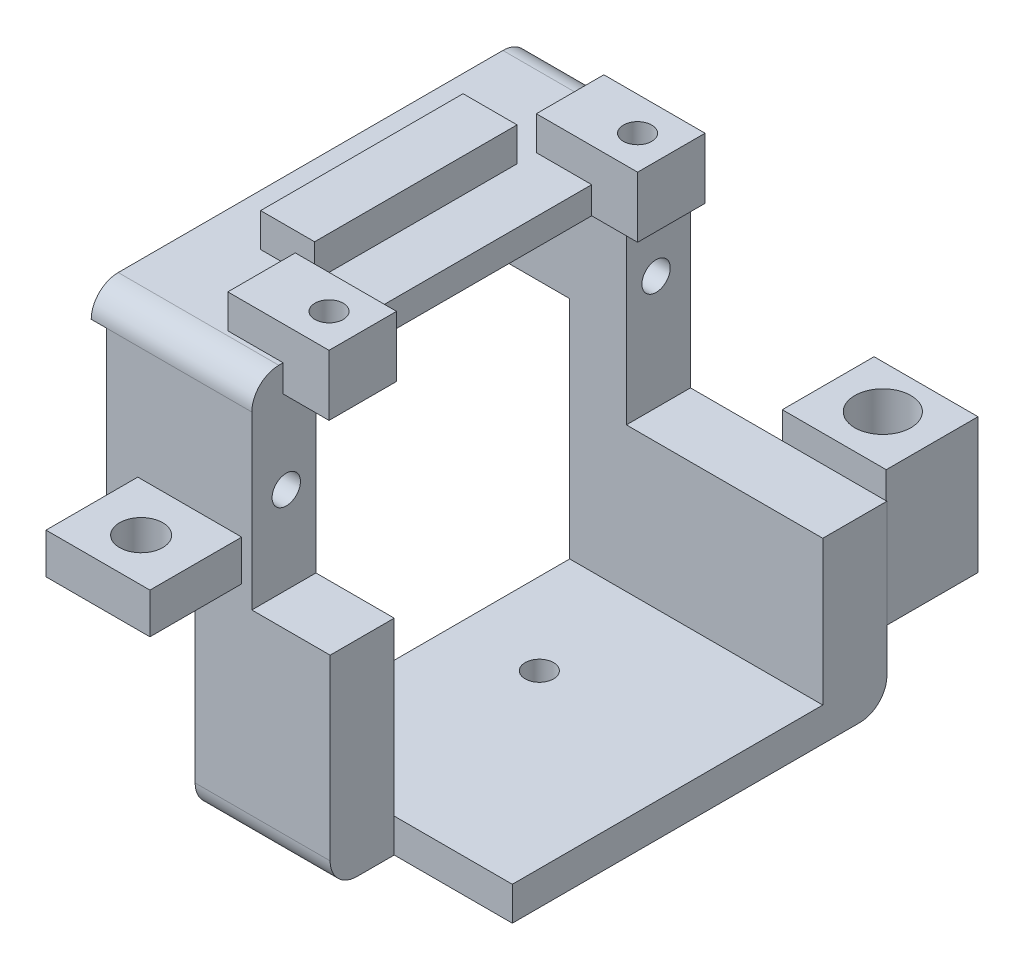
from build123d import *

# Parameters (mm, degrees)
BOSS_EXTRUDE1_DEPTH      = 2.5
BOSS_EXTRUDE2_DEPTH      = 12.7
BOSS_EXTRUDE3_START      = 12.7
SKETCH3_W                = 11.9
SKETCH3_H                = 4.75
SKETCH3_W_2              = 10.75
BOSS_EXTRUDE3_DEPTH      = 12.7
BOSS_EXTRUDE4_START      = 25.4
SKETCH3_3_W              = 11.9
SKETCH3_3_H              = 4.75
SKETCH3_3_W_2            = 10.75
SKETCH3_3_W_3            = 1.15
BOSS_EXTRUDE4_DEPTH      = 2
CUT_EXTRUDE1_START       = -1.1
SKETCH2_R                = 1.05
CUT_EXTRUDE1_DEPTH       = 8
CUT_EXTRUDE2_START       = 3.1
SKETCH2_3_R              = 1.05
CUT_EXTRUDE2_DEPTH       = 8
BOSS_EXTRUDE5_START      = 17
SKETCH1_4_R              = 1.6
BOSS_EXTRUDE5_DEPTH      = 3
BOSS_EXTRUDE6_START      = 12.7
SKETCH1_7_W              = 7.7
SKETCH1_7_H              = 6.8
SKETCH1_7_R              = 2.075
BOSS_EXTRUDE6_DEPTH      = 10
FILLET1_R                = 2
CUT_EXTRUDE3_START       = 12.7
SKETCH5_W                = 14.55
SKETCH5_H                = 4.75
CUT_EXTRUDE3_DEPTH       = 2
CUT_EXTRUDE4_START       = 12.7
SKETCH6_W                = 7.7
SKETCH6_H                = 4.75
CUT_EXTRUDE4_DEPTH       = 4
BOSS_EXTRUDE7_DEPTH      = 2.5
BOSS_EXTRUDE7_DEPTH_BACK = 2
BOSS_EXTRUDE7_START      = 27.4
SKETCH7_W                = 4
SKETCH7_H                = 15
SKETCH7_W_2              = 5
SKETCH7_H_2              = 5
SKETCH7_R                = 1.05
SKETCH7_W_3              = 2.5
BOSS_EXTRUDE8_START      = -2.5
SKETCH8_W                = 5
SKETCH8_H                = 5
SKETCH8_R                = 1.05
BOSS_EXTRUDE8_DEPTH      = 4.1
CUT_EXTRUDE5_DEPTH       = 42.675352428
CUT_EXTRUDE5_DEPTH_BACK  = 42.675352428
SKETCH8_2_R              = 1.05
CUT_EXTRUDE6_START       = 25.4
SKETCH7_4_R              = 1.05
CUT_EXTRUDE6_DEPTH       = 4.5


with BuildPart() as part:
    # Sketch1 → Boss-Extrude1 (new body)
    with BuildSketch(Plane(origin=(0, 0, 0), x_dir=(1, 0, 0), z_dir=(0, 1, 0))):
        Polygon((-1.1, 16.25), (-1.1, -16.25), (8.9, -16.25), (8.9, -11.5), (17.65, -11.5), (17.65, 16.25), align=None)
    extrude(amount=-BOSS_EXTRUDE1_DEPTH)

    # Sketch1<3> → Boss-Extrude2 (add)
    with BuildSketch(Plane(origin=(0, 0, 0), x_dir=(1, 0, 0), z_dir=(0, 1, 0))):
        Polygon((9.9, 16.25), (-1.1, 16.25), (-1.1, 11.5), (17.65, 11.5), (17.65, 16.25), (17.6, 16.25), align=None)
        Polygon((8.9, -11.5), (-1.1, -11.5), (-1.1, -16.25), (2.35, -16.25), (8.9, -16.25), align=None)
    extrude(amount=BOSS_EXTRUDE2_DEPTH)

    # Sketch3 → Boss-Extrude3 (add)
    with BuildSketch(Plane(origin=(0, 0, 0), x_dir=(1, 0, 0), z_dir=(0, 1, 0)).offset(BOSS_EXTRUDE3_START)):
        with Locations((-2.85, 13.875)):
            Rectangle(SKETCH3_W, SKETCH3_H)
        with Locations((-2.275, -13.875)):
            Rectangle(SKETCH3_W_2, SKETCH3_H)
    extrude(amount=BOSS_EXTRUDE3_DEPTH)

    # Sketch3<3> → Boss-Extrude4 (add)
    with BuildSketch(Plane(origin=(0, 0, 0), x_dir=(1, 0, 0), z_dir=(0, 1, 0)).offset(BOSS_EXTRUDE4_START)):
        with Locations((-2.85, 13.875)):
            Rectangle(SKETCH3_3_W, SKETCH3_3_H)
        Polygon((3.1, -11.5), (3.1, 11.5), (-8.8, 11.5), (-8.8, -11.5), (-7.65, -11.5), align=None)
        with Locations((-2.275, -13.875)):
            Rectangle(SKETCH3_3_W_2, SKETCH3_3_H)
        with Locations((-8.225, -13.875)):
            Rectangle(SKETCH3_3_W_3, SKETCH3_3_H)
    extrude(amount=BOSS_EXTRUDE4_DEPTH)

    # Sketch2 → Cut-Extrude1 (cut)
    with BuildSketch(Plane(origin=(0, 0, 0), x_dir=(0, 0, -1), z_dir=(1, 0, 0)).offset(CUT_EXTRUDE1_START)):
        with Locations(Location((-13.7, 6.45, 0), (0, 0, 180))):
            Circle(SKETCH2_R)
        with Locations(Location((13.7, 6.45, 0), (0, 0, 180))):
            Circle(SKETCH2_R)
    extrude(amount=CUT_EXTRUDE1_DEPTH, mode=Mode.SUBTRACT)

    # Sketch2<3> → Cut-Extrude2 (cut)
    with BuildSketch(Plane(origin=(0, 0, 0), x_dir=(0, 0, -1), z_dir=(1, 0, 0)).offset(CUT_EXTRUDE2_START)):
        with Locations(Location((13.7, 19.15, 0), (0, 0, 180))):
            Circle(SKETCH2_3_R)
        with Locations(Location((-13.7, 19.15, 0), (0, 0, 180))):
            Circle(SKETCH2_3_R)
    extrude(amount=-CUT_EXTRUDE2_DEPTH, mode=Mode.SUBTRACT)

    # Sketch1<4> → Boss-Extrude5 (add)
    with BuildSketch(Plane(origin=(0, 0, 0), x_dir=(1, 0, 0), z_dir=(0, 1, 0)).offset(BOSS_EXTRUDE5_START)):
        Polygon((2.35, -16.25), (-1.1, -16.25), (-3.8, -16.25), (-5.35, -16.25), (-5.35, -23.05), (2.35, -23.05), align=None)
        with Locations(Location((-1.5, -19.85, 0), (0, 0, 270))):
            Circle(SKETCH1_4_R, mode=Mode.SUBTRACT)
    extrude(amount=-BOSS_EXTRUDE5_DEPTH)

    # Sketch1<7> → Boss-Extrude6 (add)
    with BuildSketch(Plane(origin=(0, 0, 0), x_dir=(1, 0, 0), z_dir=(0, 1, 0)).offset(BOSS_EXTRUDE6_START)):
        with Locations((13.75, 19.65)):
            Rectangle(SKETCH1_7_W, SKETCH1_7_H)
        with Locations(Location((13.75, 19.85, 0), (0, 0, 270))):
            Circle(SKETCH1_7_R, mode=Mode.SUBTRACT)
    extrude(amount=-BOSS_EXTRUDE6_DEPTH)

    # Fillet1
    fillet1_edges = [part.edges().sort_by_distance(p)[0] for p in [
        (3.9, -2.5, 16.25),
        (-2.85, 27.4, 16.25),
        (8.275, -2.5, -16.25),
        (-2.85, 27.4, -16.25),
    ]]
    fillet(fillet1_edges, radius=FILLET1_R)

    # Sketch5 → Cut-Extrude3 (cut)
    with BuildSketch(Plane(origin=(0, 0, 0), x_dir=(1, 0, 0), z_dir=(0, 1, 0)).offset(CUT_EXTRUDE3_START)):
        with Locations((10.375, 13.875)):
            Rectangle(SKETCH5_W, SKETCH5_H)
    extrude(amount=-CUT_EXTRUDE3_DEPTH, mode=Mode.SUBTRACT)

    # Sketch6 → Cut-Extrude4 (cut)
    with BuildSketch(Plane(origin=(0, 0, 0), x_dir=(1, 0, 0), z_dir=(0, 1, 0)).offset(CUT_EXTRUDE4_START)):
        with Locations((-4.95, 13.875)):
            Rectangle(SKETCH6_W, SKETCH6_H)
    extrude(amount=CUT_EXTRUDE4_DEPTH, mode=Mode.SUBTRACT)

    # Sketch7 → Boss-Extrude7 (add, two sides: drawn at the far end of the back side and taken through both)
    # profile 1 of 5: a face of its own
    with BuildSketch(Plane(origin=(0, 0, 0), x_dir=(1, 0, 0), z_dir=(0, 1, 0)).offset(BOSS_EXTRUDE7_START - BOSS_EXTRUDE7_DEPTH_BACK)):
        with Locations((-3, 0)):
            Rectangle(SKETCH7_W, SKETCH7_H)
    # profile 2 of 5: a face of its own
    with BuildSketch(Plane(origin=(0, 0, 0), x_dir=(1, 0, 0), z_dir=(0, 1, 0)).offset(BOSS_EXTRUDE7_START - BOSS_EXTRUDE7_DEPTH_BACK)):
        with Locations((4, -11.43)):
            Rectangle(SKETCH7_W_2, SKETCH7_H_2)
        with Locations(Location((4, -11.43, 0), (0, 0, 211.002719134))):
            Circle(SKETCH7_R, mode=Mode.SUBTRACT)
    # profile 3 of 5: a face of its own
    with BuildSketch(Plane(origin=(0, 0, 0), x_dir=(1, 0, 0), z_dir=(0, 1, 0)).offset(BOSS_EXTRUDE7_START - BOSS_EXTRUDE7_DEPTH_BACK)):
        with Locations((0.25, -11.43)):
            Rectangle(SKETCH7_W_3, SKETCH7_H_2)
    # profile 4 of 5: a face of its own
    with BuildSketch(Plane(origin=(0, 0, 0), x_dir=(1, 0, 0), z_dir=(0, 1, 0)).offset(BOSS_EXTRUDE7_START - BOSS_EXTRUDE7_DEPTH_BACK)):
        with Locations((0.25, 11.43)):
            Rectangle(SKETCH7_W_3, SKETCH7_H_2)
    # profile 5 of 5: a face of its own
    with BuildSketch(Plane(origin=(0, 0, 0), x_dir=(1, 0, 0), z_dir=(0, 1, 0)).offset(BOSS_EXTRUDE7_START - BOSS_EXTRUDE7_DEPTH_BACK)):
        with Locations((4, 11.43)):
            Rectangle(SKETCH7_W_2, SKETCH7_H_2)
        with Locations(Location((4, 11.43, 0), (0, 0, 211.002719134))):
            Circle(SKETCH7_R, mode=Mode.SUBTRACT)
    extrude(amount=BOSS_EXTRUDE7_DEPTH + BOSS_EXTRUDE7_DEPTH_BACK)

    # Sketch8 → Boss-Extrude8 (add)
    with BuildSketch(Plane(origin=(0, 0, 0), x_dir=(1, 0, 0), z_dir=(0, 1, 0)).offset(BOSS_EXTRUDE8_START)):
        with Locations((4.95, 3.2)):
            Rectangle(SKETCH8_W, SKETCH8_H)
        with Locations(Location((4.95, 3.2, 0), (0, 0, 270))):
            Circle(SKETCH8_R, mode=Mode.SUBTRACT)
    extrude(amount=-BOSS_EXTRUDE8_DEPTH)

    # Sketch8<2> → Cut-Extrude5 (cut, two sides: drawn at the far end of the back side and taken through both)
    with BuildSketch(Plane(origin=(0, 0, 0), x_dir=(1, 0, 0), z_dir=(0, 1, 0)).offset(-CUT_EXTRUDE5_DEPTH_BACK)):
        with Locations(Location((4.95, 3.2, 0), (0, 0, 270))):
            Circle(SKETCH8_2_R)
    extrude(amount=CUT_EXTRUDE5_DEPTH + CUT_EXTRUDE5_DEPTH_BACK, mode=Mode.SUBTRACT)

    # Sketch7<4> → Cut-Extrude6 (cut)
    with BuildSketch(Plane(origin=(0, 0, 0), x_dir=(1, 0, 0), z_dir=(0, 1, 0)).offset(CUT_EXTRUDE6_START)):
        with Locations(Location((4, 11.43, 0), (0, 0, 176.177446271))):
            Circle(SKETCH7_4_R)
        with Locations(Location((4, -11.43, 0), (0, 0, 211.002719134))):
            Circle(SKETCH7_4_R)
    extrude(amount=CUT_EXTRUDE6_DEPTH, mode=Mode.SUBTRACT)


solid = part.part
